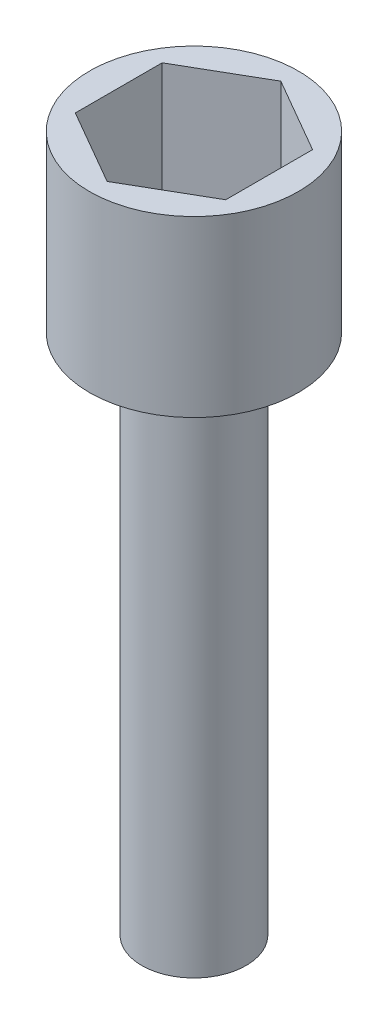
from build123d import *

# Parameters (mm, degrees)
ESQUISSE1_R             = 1.5
BOSS_EXTRU_1_DEPTH      = 15
ESQUISSE2_R             = 3
BOSS_EXTRU_2_DEPTH      = 5
ENL_V_MAT_EXTRU_1_DEPTH = 4


with BuildPart() as part:
    # Esquisse1 → Boss.-Extru.1 (new body)
    with BuildSketch(Plane(origin=(0, 0, 0), x_dir=(1, 0, 0), z_dir=(0, 1, 0))):
        with Locations(Location((0, 0, 0), (0, 0, 270))):
            Circle(ESQUISSE1_R)
    extrude(amount=BOSS_EXTRU_1_DEPTH)

    # Esquisse2 → Boss.-Extru.2 (add)
    with BuildSketch(Plane(origin=(0, 15, 0), x_dir=(1, 0, 0), z_dir=(0, 1, 0))):
        with Locations(Location((0, 0, 0), (0, 0, 270))):
            Circle(ESQUISSE2_R)
    extrude(amount=BOSS_EXTRU_2_DEPTH)

    # Esquisse3 → Enlèv. mat.-Extru.1 (cut)
    with BuildSketch(Plane(origin=(0, 20, 0), x_dir=(1, 0, 0), z_dir=(0, 1, 0))):
        Polygon((0, 2.494145106), (-2.159993023, 1.247072553), (-2.159993023, -1.247072553), (0, -2.494145106), (2.159993023, -1.247072553), (2.159993023, 1.247072553), align=None)
    extrude(amount=-ENL_V_MAT_EXTRU_1_DEPTH, mode=Mode.SUBTRACT)


solid = part.part
